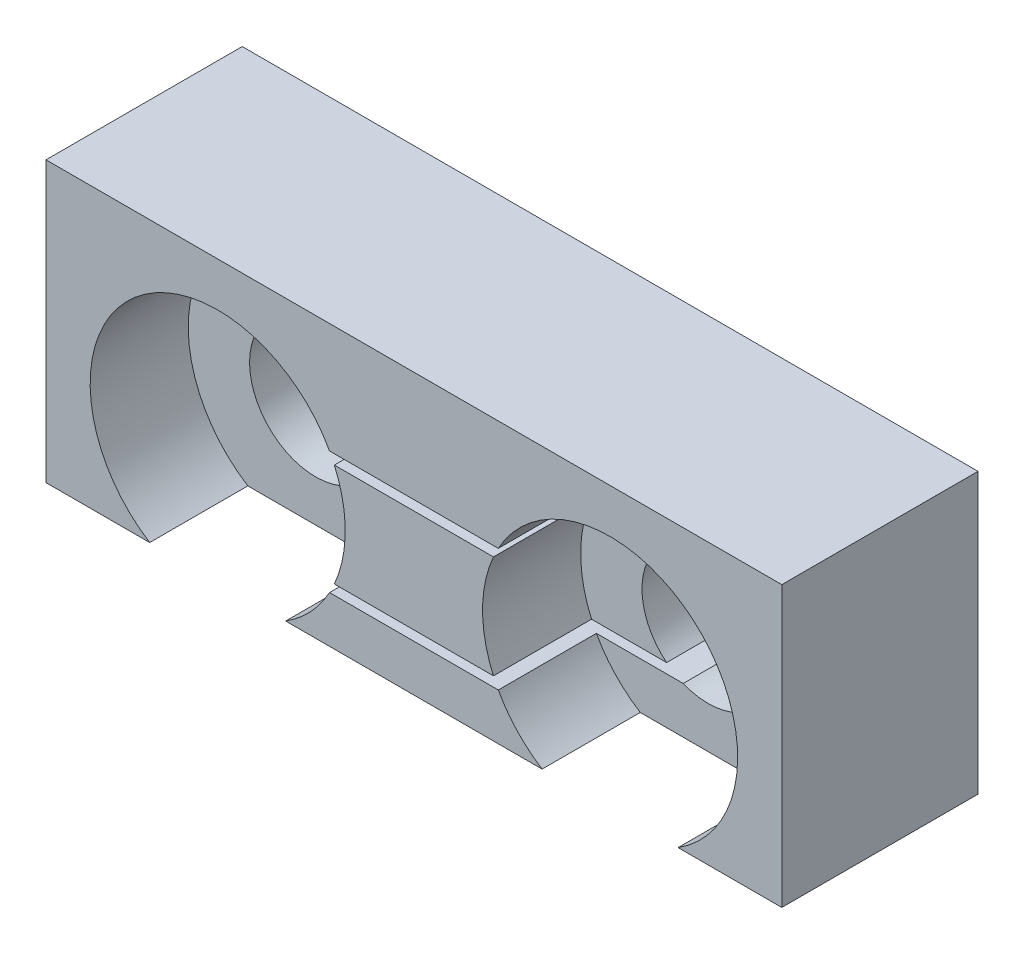
from build123d import *

# Parameters (mm, degrees)
SKETCH1_W                     = 150
SKETCH1_H                     = 70
BOSS_EXTRUDE1_DEPTH           = 40
SHAFTFITS_REACH               = 93.924
SKETCH2_R                     = 2.75
SKETCH3_R                     = 12.5
PULLEY_DEPTH                  = 30
SKETCH4_R                     = 25
GEARS_FITS_DEPTH              = 20
GEAR_LETOUT_REACH             = 93.924
SKETCH5_W                     = 150
SKETCH5_H                     = 13
CLOSED_LOOP_TIMING_BELT_REACH = 93.924
SKETCH8_W                     = 80
SKETCH8_H                     = 2
SKETCH6_R                     = 26
GEAR_MARGIN_DEPTH             = 20
SKETCH7_R                     = 13.5
PULLEY_MARGIN_DEPTH           = 10


with BuildPart() as part:
    # Sketch1 → Boss-Extrude1 (new body)
    with BuildSketch(Plane.XY):
        Rectangle(SKETCH1_W, SKETCH1_H)
    extrude(amount=BOSS_EXTRUDE1_DEPTH)

    # Sketch2 → ShaftFits (cut, up to next)
    with BuildSketch(Plane.XY.offset(40), mode=Mode.PRIVATE) as shaftfits_sk1:
        with Locations((40, 0)):
            Circle(SKETCH2_R)
    shaftfits_tool1 = extrude(shaftfits_sk1.sketch, amount=-SHAFTFITS_REACH, mode=Mode.PRIVATE) & part.part
    # Sketch2 → ShaftFits (cut, up to next)
    with BuildSketch(Plane.XY.offset(40), mode=Mode.PRIVATE) as shaftfits_sk2:
        with Locations(Location((-40, 0, 0), (0, 0, 180))):
            Circle(SKETCH2_R)
    shaftfits_tool2 = extrude(shaftfits_sk2.sketch, amount=-SHAFTFITS_REACH, mode=Mode.PRIVATE) & part.part
    add(shaftfits_tool1.solids().sort_by_distance((40, 0, 40))[0], mode=Mode.SUBTRACT)
    add(shaftfits_tool2.solids().sort_by_distance((-40, 0, 40))[0], mode=Mode.SUBTRACT)

    # Sketch3 → Pulley (cut)
    with BuildSketch(Plane.XY.offset(40)):
        with Locations((40, 0)):
            Circle(SKETCH3_R)
        with Locations(Location((-40, 0, 0), (0, 0, 180))):
            Circle(SKETCH3_R)
    extrude(amount=-PULLEY_DEPTH, mode=Mode.SUBTRACT)

    # Sketch4 → Gears fits (cut)
    with BuildSketch(Plane.XY.offset(40)):
        with Locations((40, 0)):
            Circle(SKETCH4_R)
        with Locations(Location((-40, 0, 0), (0, 0, 180))):
            Circle(SKETCH4_R)
    extrude(amount=-GEARS_FITS_DEPTH, mode=Mode.SUBTRACT)

    # Sketch5 → Gear letout (cut, up to next)
    with BuildSketch(Plane.XY.offset(40), mode=Mode.PRIVATE) as gear_letout_sk1:
        with Locations((0, -28.5)):
            Rectangle(SKETCH5_W, SKETCH5_H)
    gear_letout_tool1 = extrude(gear_letout_sk1.sketch, amount=-GEAR_LETOUT_REACH, mode=Mode.PRIVATE) & part.part
    add(gear_letout_tool1.solids().sort_by_distance((0, -28.5, 40))[0], mode=Mode.SUBTRACT)

    # Closed-loop timing belt: up to this face of the body (flat: up to its plane)
    closed_loop_timing_belt_end = Plane(part.part.faces().sort_by_distance((-27.853553391, 0, 10))[0])
    # Sketch8 → Closed-loop timing belt (cut, up to the picked face)
    with BuildSketch(Plane.XY.offset(40), mode=Mode.PRIVATE) as closed_loop_timing_belt_sk1:
        with Locations((0, 11.5)):
            Rectangle(SKETCH8_W, SKETCH8_H)
    closed_loop_timing_belt_tool1 = split(extrude(closed_loop_timing_belt_sk1.sketch, amount=-CLOSED_LOOP_TIMING_BELT_REACH, mode=Mode.PRIVATE), bisect_by=closed_loop_timing_belt_end, keep=Keep.BOTH, mode=Mode.PRIVATE)
    # Sketch8 → Closed-loop timing belt (cut, up to the picked face)
    with BuildSketch(Plane.XY.offset(40), mode=Mode.PRIVATE) as closed_loop_timing_belt_sk2:
        with Locations((0, -11.5)):
            Rectangle(SKETCH8_W, SKETCH8_H)
    closed_loop_timing_belt_tool2 = split(extrude(closed_loop_timing_belt_sk2.sketch, amount=-CLOSED_LOOP_TIMING_BELT_REACH, mode=Mode.PRIVATE), bisect_by=closed_loop_timing_belt_end, keep=Keep.BOTH, mode=Mode.PRIVATE)
    add(closed_loop_timing_belt_tool1.solids().sort_by(Axis((0, 11.5, 40), (0, 0, -1)))[0], mode=Mode.SUBTRACT)
    add(closed_loop_timing_belt_tool2.solids().sort_by(Axis((0, -11.5, 40), (0, 0, -1)))[0], mode=Mode.SUBTRACT)

    # Sketch6 → Gear margin (cut)
    with BuildSketch(Plane.XY.offset(40)):
        with Locations((40, 0)):
            Circle(SKETCH6_R)
        with Locations((-40, 0)):
            Circle(SKETCH6_R)
    extrude(amount=-GEAR_MARGIN_DEPTH, mode=Mode.SUBTRACT)

    # Sketch7 → Pulley margin (cut)
    with BuildSketch(Plane.XY.offset(20)):
        with Locations((40, 0)):
            Circle(SKETCH7_R)
        with Locations((-40, 0)):
            Circle(SKETCH7_R)
    extrude(amount=-PULLEY_MARGIN_DEPTH, mode=Mode.SUBTRACT)


solid = part.part
